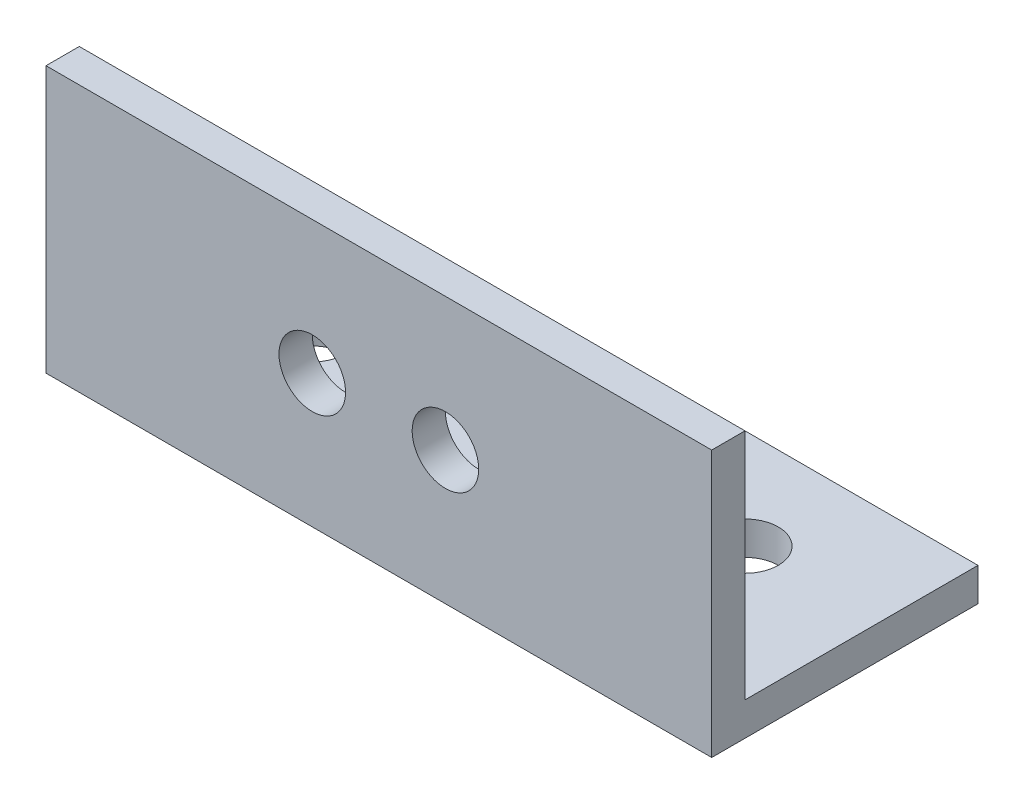
from build123d import *

# Parameters (mm, degrees)
SKETCH1_W           = 63.5
SKETCH1_H           = 25.4
BOSS_EXTRUDE1_DEPTH = 3.175
SKETCH2_W           = 63.5
SKETCH2_H           = 3.175
BOSS_EXTRUDE2_DEPTH = 22.225
SKETCH3_R           = 3.175
CUT_EXTRUDE1_DEPTH  = 3.175
SKETCH4_R           = 3.175
CUT_EXTRUDE2_DEPTH  = 3.175


with BuildPart() as part:
    # Sketch1 → Boss-Extrude1 (new body)
    with BuildSketch(Plane(origin=(0, 0, 0), x_dir=(1, 0, 0), z_dir=(0, 1, 0))):
        Rectangle(SKETCH1_W, SKETCH1_H)
    extrude(amount=BOSS_EXTRUDE1_DEPTH)

    # Sketch2 → Boss-Extrude2 (add)
    with BuildSketch(Plane(origin=(0, 3.175, 0), x_dir=(1, 0, 0), z_dir=(0, 1, 0))):
        with Locations((0, -11.1125)):
            Rectangle(SKETCH2_W, SKETCH2_H)
    extrude(amount=BOSS_EXTRUDE2_DEPTH)

    # Sketch3 → Cut-Extrude1 (cut)
    with BuildSketch(Plane(origin=(0, 0, 9.525), x_dir=(-1, 0, 0), z_dir=(0, 0, -1))):
        with Locations((6.35, 12.7)):
            Circle(SKETCH3_R)
        with Locations((-6.35, 12.7)):
            Circle(SKETCH3_R)
    extrude(amount=-CUT_EXTRUDE1_DEPTH, mode=Mode.SUBTRACT)

    # Sketch4 → Cut-Extrude2 (cut)
    with BuildSketch(Plane(origin=(0, 3.175, 0), x_dir=(1, 0, 0), z_dir=(0, 1, 0))):
        with Locations(Location((-19.05, 0, 0), (0, 0, 270))):
            Circle(SKETCH4_R)
        with Locations(Location((19.05, 3.175, 0), (0, 0, 270))):
            Circle(SKETCH4_R)
    extrude(amount=-CUT_EXTRUDE2_DEPTH, mode=Mode.SUBTRACT)


solid = part.part
